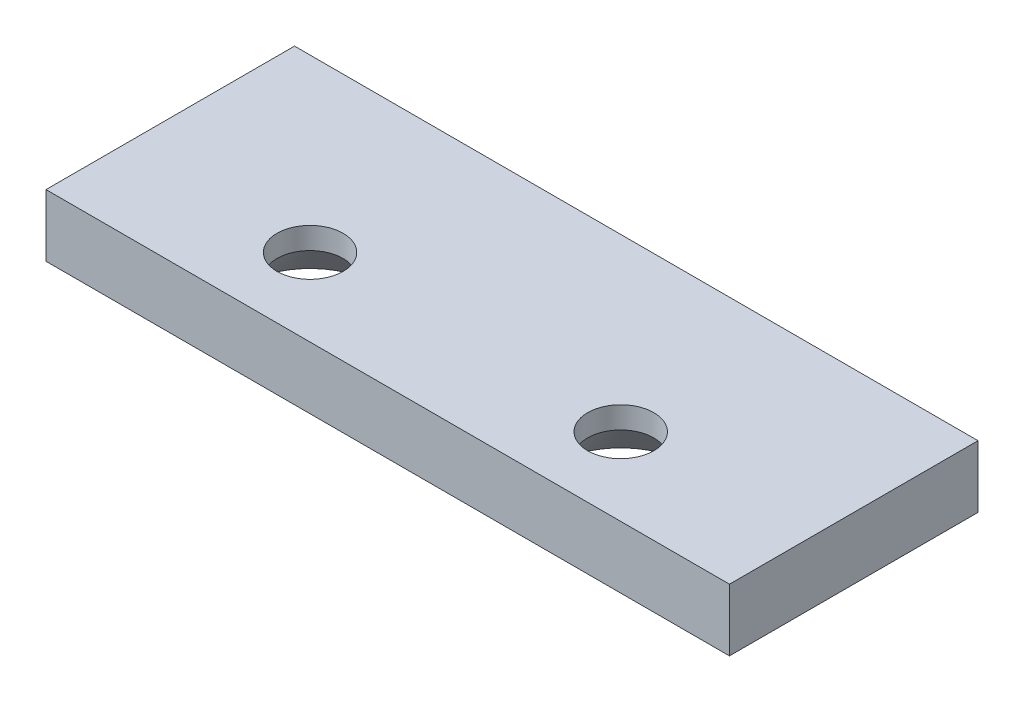
from build123d import *

# Parameters (mm, degrees)
SKETCH1_W                                        = 69.85
SKETCH1_H                                        = 25.4
BOSS_EXTRUDE1_DEPTH                              = 6.35
CSK_FOR_1_4_FLAT_HEAD_MACHINE_SCREW1_D           = 6.7564
CSK_FOR_1_4_FLAT_HEAD_MACHINE_SCREW1_DEPTH       = 15.24
CSK_FOR_1_4_FLAT_HEAD_MACHINE_SCREW1_CSINK_D     = 13.9192
CSK_FOR_1_4_FLAT_HEAD_MACHINE_SCREW1_CSINK_ANGLE = 82
CSK_FOR_1_4_FLAT_HEAD_MACHINE_SCREW1_TIP         = 2.029827343


with BuildPart() as part:
    # Sketch1 → Boss-Extrude1 (new body)
    with BuildSketch(Plane(origin=(0, 0, 0), x_dir=(1, 0, 0), z_dir=(0, 1, 0))):
        Rectangle(SKETCH1_W, SKETCH1_H)
    extrude(amount=BOSS_EXTRUDE1_DEPTH)

    # CSK for 1/4 Flat Head Machine Screw1
    with Locations(Plane(origin=(0, 0, 0), x_dir=(-1, 0, 0), z_dir=(0, -1, 0))):
        with Locations((15.875, -4.7625), (-15.875, -4.7625)):
            CounterSinkHole(CSK_FOR_1_4_FLAT_HEAD_MACHINE_SCREW1_D / 2, CSK_FOR_1_4_FLAT_HEAD_MACHINE_SCREW1_CSINK_D / 2, depth=CSK_FOR_1_4_FLAT_HEAD_MACHINE_SCREW1_DEPTH, counter_sink_angle=CSK_FOR_1_4_FLAT_HEAD_MACHINE_SCREW1_CSINK_ANGLE)
            with Locations((0, 0, -(CSK_FOR_1_4_FLAT_HEAD_MACHINE_SCREW1_DEPTH + CSK_FOR_1_4_FLAT_HEAD_MACHINE_SCREW1_TIP / 2))):  # 118° drill point
                Cone(0, CSK_FOR_1_4_FLAT_HEAD_MACHINE_SCREW1_D / 2, CSK_FOR_1_4_FLAT_HEAD_MACHINE_SCREW1_TIP, mode=Mode.SUBTRACT)


solid = part.part
